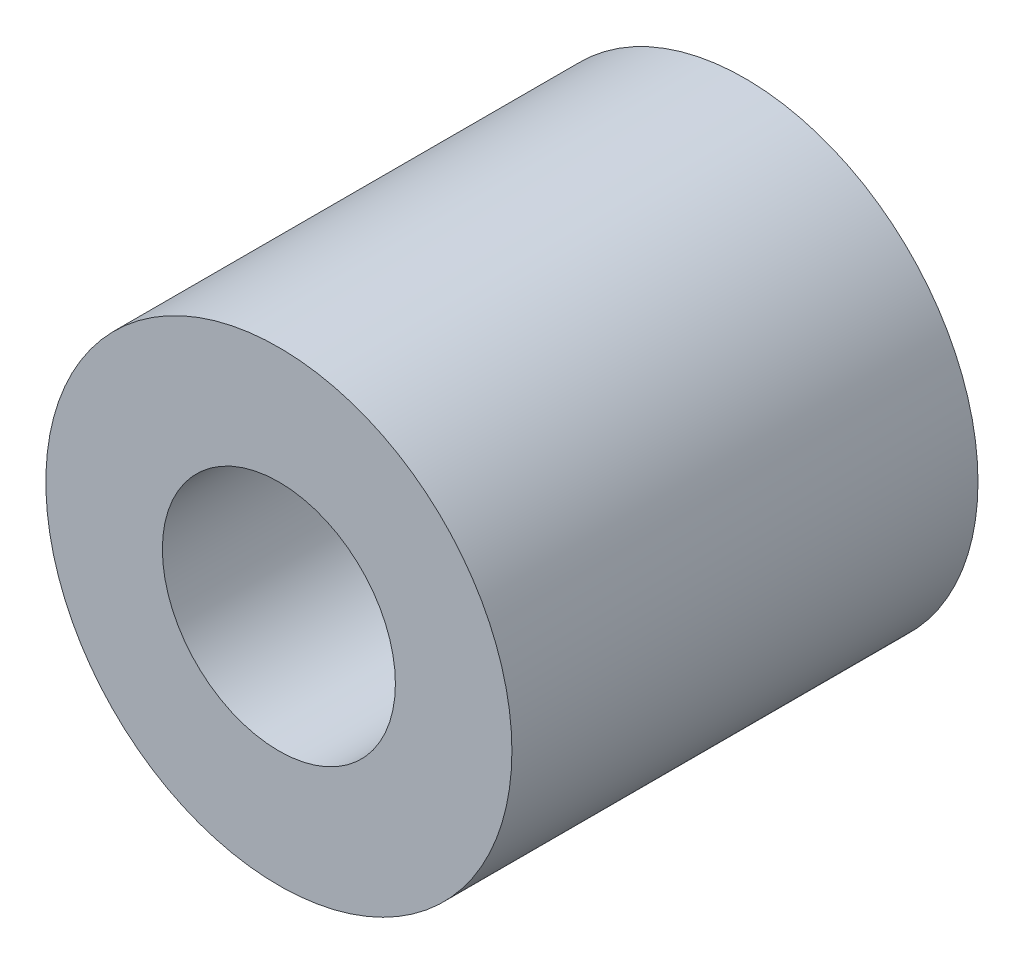
from build123d import *

# Parameters (mm, degrees)
SKETCH_1_R      = 2.5
SKETCH_1_R_2    = 1.25
EXTRUDE_1_DEPTH = 5


with BuildPart() as part:
    # 草图1 → 凸台-拉伸1 (new body)
    with BuildSketch(Plane.XY):
        Circle(SKETCH_1_R)
        Circle(SKETCH_1_R_2, mode=Mode.SUBTRACT)
    extrude(amount=EXTRUDE_1_DEPTH)


solid = part.part
